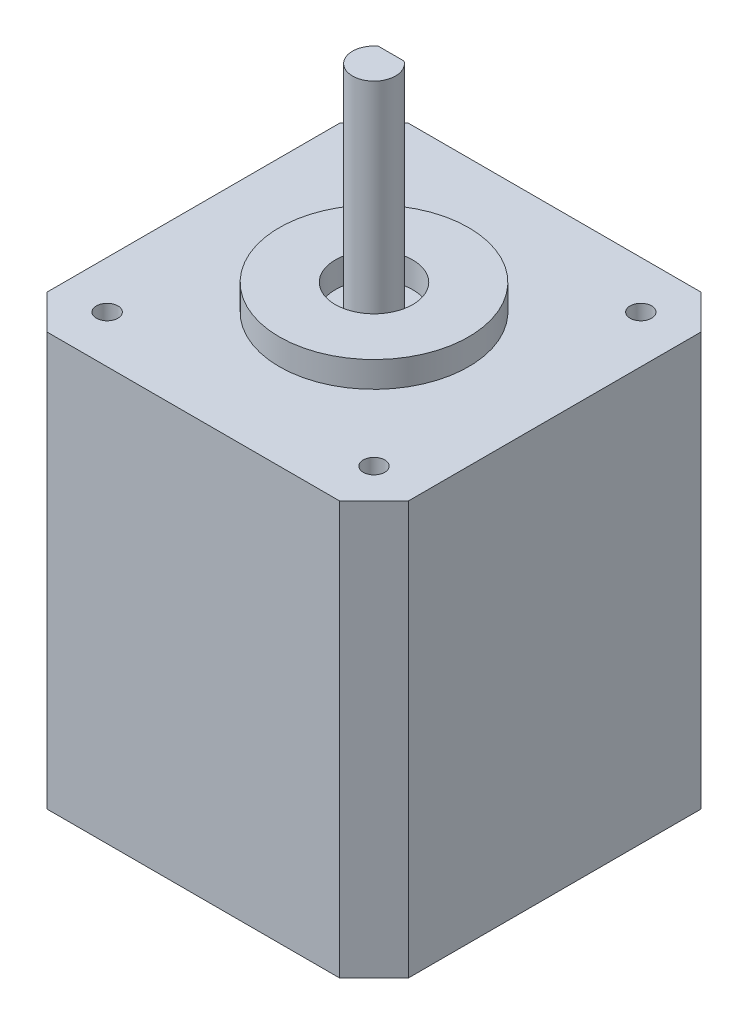
from build123d import *

# Parameters (mm, degrees)
CROQUIS1_W                = 42
CROQUIS1_H                = 42
SALIENTE_EXTRUIR1_DEPTH   = 48
CROQUIS2_R                = 11
CROQUIS2_R_2              = 4.5
SALIENTE_EXTRUIR2_DEPTH   = 3
SALIENTE_EXTRUIR3_DEPTH   = 25
TALADRO_ROSCADO_M31_D     = 2.5
TALADRO_ROSCADO_M31_DEPTH = 8.5
TALADRO_ROSCADO_M31_TIP   = 0.751075774
CHAFL_N1_SIZE             = 4


with BuildPart() as part:
    # Croquis1 → Saliente-Extruir1 (new body)
    with BuildSketch(Plane(origin=(0, 0, 0), x_dir=(1, 0, 0), z_dir=(0, 1, 0))):
        Rectangle(CROQUIS1_W, CROQUIS1_H)
    extrude(amount=SALIENTE_EXTRUIR1_DEPTH)

    # Croquis2 → Saliente-Extruir2 (add)
    with BuildSketch(Plane(origin=(0, 48, 0), x_dir=(1, 0, 0), z_dir=(0, 1, 0))):
        with Locations(Location((0, 0, 0), (0, 0, 270))):
            Circle(CROQUIS2_R)
        with Locations(Location((0, 0, 0), (0, 0, 270))):
            Circle(CROQUIS2_R_2, mode=Mode.SUBTRACT)
    extrude(amount=SALIENTE_EXTRUIR2_DEPTH)

    # Croquis3 → Saliente-Extruir3 (add)
    with BuildSketch(Plane(origin=(0, 48, 0), x_dir=(1, 0, 0), z_dir=(0, 1, 0))):
        with BuildLine():
            Line((1.5, 2), (-1.5, 2))
            ThreePointArc((-1.5, 2), (0, -2.5), (1.5, 2))
        make_face()
    extrude(amount=SALIENTE_EXTRUIR3_DEPTH)

    # Taladro roscado M31
    with Locations(Plane(origin=(0, 48, 0), x_dir=(1, 0, 0), z_dir=(0, 1, 0))):
        with Locations((-15.5, 15.5), (-15.5, -15.5), (15.5, -15.5), (15.5, 15.5)):
            Hole(TALADRO_ROSCADO_M31_D / 2, depth=TALADRO_ROSCADO_M31_DEPTH)
            with Locations((0, 0, -(TALADRO_ROSCADO_M31_DEPTH + TALADRO_ROSCADO_M31_TIP / 2))):  # 118° drill point
                Cone(0, TALADRO_ROSCADO_M31_D / 2, TALADRO_ROSCADO_M31_TIP, mode=Mode.SUBTRACT)

    # Chaflán1
    chafl_n1_edges = [part.edges().sort_by_distance(p)[0] for p in [
        (-21, 24, -21),
        (21, 24, -21),
        (21, 24, 21),
        (-21, 24, 21),
    ]]
    chamfer(chafl_n1_edges, length=CHAFL_N1_SIZE)


solid = part.part
